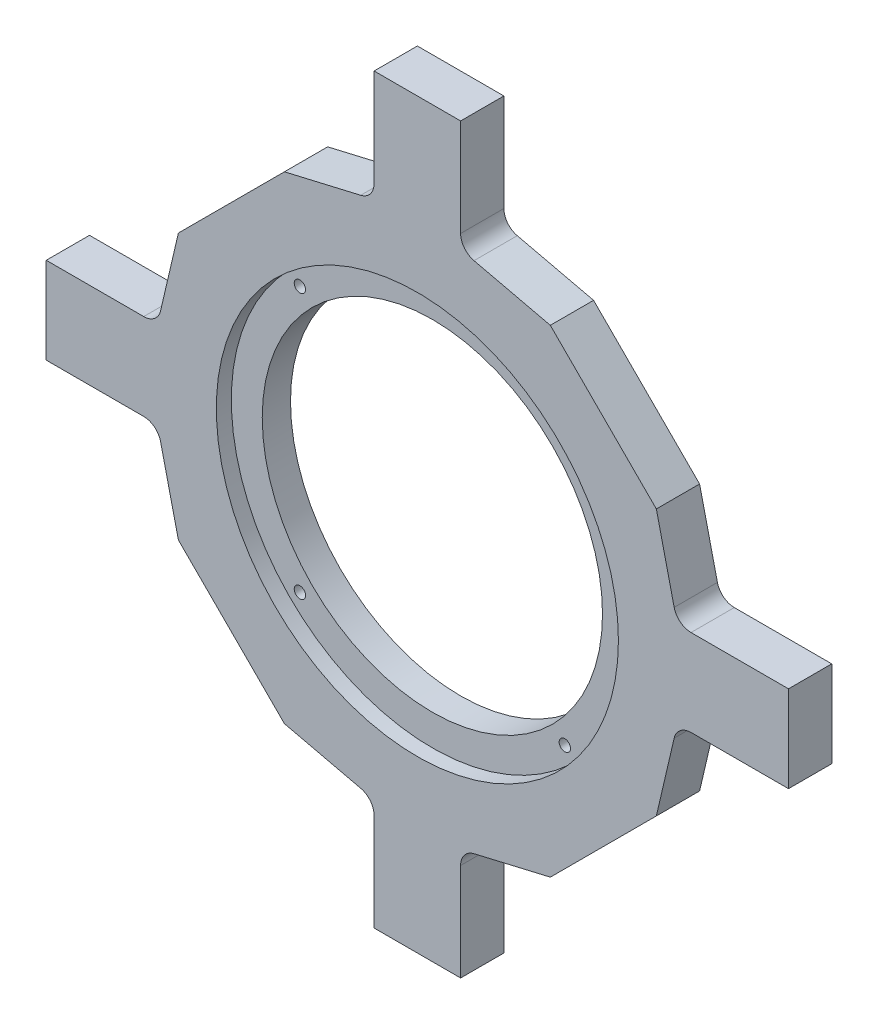
from build123d import *

# Parameters (mm, degrees)
BOSS_EXTRUDE1_DEPTH = 19.05
SKETCH2_R           = 74.93
CUT_EXTRUDE1_DEPTH  = 232.935451585
SKETCH3_R           = 88.546370902
CUT_EXTRUDE2_DEPTH  = 6.604
SKETCH4_R           = 2.5
CUT_EXTRUDE3_DEPTH  = 232.486617579


with BuildPart() as part:
    # Sketch1 → Boss-Extrude1 (new body)
    with BuildSketch(Plane.XY):
        with BuildLine():
            Line((-19.05, 120.51752167), (-19.05, 163.449))
            Line((-19.05, 163.449), (19.05, 163.449))
            Line((19.05, 163.449), (19.05, 120.51752167))
            ThreePointArc((19.05, 120.51752167), (20.700629733, 115.781382038), (24.937406462, 113.097109308))
            Line((24.937406462, 113.097109308), (58.551269909, 105.248601739))
            Line((58.551269909, 105.248601739), (105.248601739, 58.551269909))
            Line((105.248601739, 58.551269909), (113.097109308, 24.937406462))
            ThreePointArc((113.097109308, 24.937406462), (115.781382038, 20.700629733), (120.51752167, 19.05))
            Line((120.51752167, 19.05), (163.449, 19.05))
            Line((163.449, 19.05), (163.449, -19.05))
            Line((163.449, -19.05), (120.51752167, -19.05))
            ThreePointArc((120.51752167, -19.05), (115.781382038, -20.700629733), (113.097109308, -24.937406462))
            Line((113.097109308, -24.937406462), (105.248601739, -58.551269909))
            Line((105.248601739, -58.551269909), (58.551269909, -105.248601739))
            Line((58.551269909, -105.248601739), (24.937406462, -113.097109308))
            ThreePointArc((24.937406462, -113.097109308), (20.700629733, -115.781382038), (19.05, -120.51752167))
            Line((19.05, -120.51752167), (19.05, -163.449))
            Line((19.05, -163.449), (-19.05, -163.449))
            Line((-19.05, -163.449), (-19.05, -120.51752167))
            ThreePointArc((-19.05, -120.51752167), (-20.700629733, -115.781382038), (-24.937406462, -113.097109308))
            Line((-24.937406462, -113.097109308), (-58.551269909, -105.248601739))
            Line((-58.551269909, -105.248601739), (-105.248601739, -58.551269909))
            Line((-105.248601739, -58.551269909), (-113.097109308, -24.937406462))
            ThreePointArc((-113.097109308, -24.937406462), (-115.781382038, -20.700629733), (-120.51752167, -19.05))
            Line((-120.51752167, -19.05), (-163.449, -19.05))
            Line((-163.449, -19.05), (-163.449, 19.05))
            Line((-163.449, 19.05), (-120.51752167, 19.05))
            ThreePointArc((-120.51752167, 19.05), (-115.781382038, 20.700629733), (-113.097109308, 24.937406462))
            Line((-113.097109308, 24.937406462), (-105.248601739, 58.551269909))
            Line((-105.248601739, 58.551269909), (-58.551269909, 105.248601739))
            Line((-58.551269909, 105.248601739), (-24.937406462, 113.097109308))
            ThreePointArc((-24.937406462, 113.097109308), (-20.700629733, 115.781382038), (-19.05, 120.51752167))
        make_face()
    extrude(amount=BOSS_EXTRUDE1_DEPTH)

    # Sketch2 → Cut-Extrude1 (cut, through all)
    with BuildSketch(Plane.XY.offset(19.05)):
        Circle(SKETCH2_R)
    extrude(amount=-CUT_EXTRUDE1_DEPTH, mode=Mode.SUBTRACT)

    # Sketch3 → Cut-Extrude2 (cut)
    with BuildSketch(Plane.XY.offset(19.05)):
        Circle(SKETCH3_R)
    extrude(amount=-CUT_EXTRUDE2_DEPTH, mode=Mode.SUBTRACT)

    # Sketch4 → Cut-Extrude3 (cut, through all)
    with BuildSketch(Plane.XY.offset(12.446)):
        with Locations((-58.336309448, 58.336309448)):
            Circle(SKETCH4_R)
        with Locations((58.336309448, 58.336309448)):
            Circle(SKETCH4_R)
        with Locations((58.336309448, -58.336309448)):
            Circle(SKETCH4_R)
        with Locations((-58.336309448, -58.336309448)):
            Circle(SKETCH4_R)
    extrude(amount=-CUT_EXTRUDE3_DEPTH, mode=Mode.SUBTRACT)


solid = part.part
